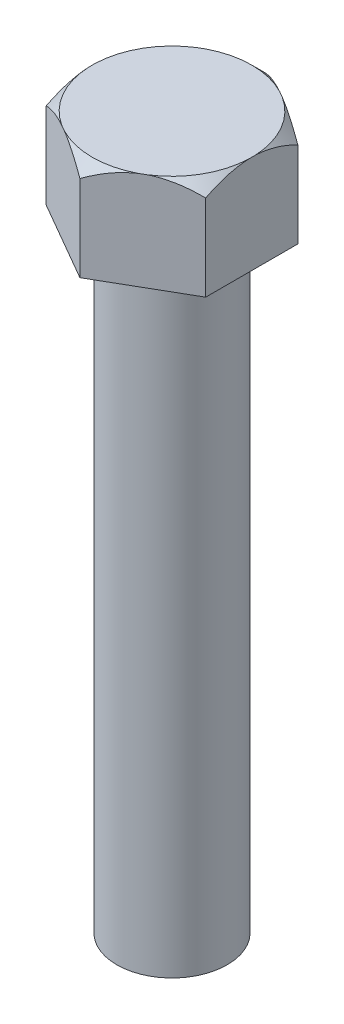
from build123d import *

# Parameters (mm, degrees)
SKETCH1_R           = 2.25
BOSS_EXTRUDE1_DEPTH = 25
BOSS_EXTRUDE2_DEPTH = 4


with BuildPart() as part:
    # Sketch1 → Boss-Extrude1 (new body)
    with BuildSketch(Plane(origin=(0, 0, 0), x_dir=(1, 0, 0), z_dir=(0, 1, 0))):
        with Locations(Location((0, 0, 0), (0, 0, 270))):
            Circle(SKETCH1_R)
    extrude(amount=BOSS_EXTRUDE1_DEPTH)

    # Sketch2 → Boss-Extrude2 (add)
    with BuildSketch(Plane(origin=(0, 25, 0), x_dir=(1, 0, 0), z_dir=(0, 1, 0))):
        Polygon((-3.25, -1.876388375), (0, -3.75277675), (3.25, -1.876388375), (3.25, 1.876388375), (0, 3.75277675), (-3.25, 1.876388375), align=None)
    extrude(amount=BOSS_EXTRUDE2_DEPTH)

    # Sketch4 → Cut-Revolve1 (revolve, cut)
    with BuildSketch(Plane(origin=(0, 0, 0), x_dir=(0, 0, -1), z_dir=(1, 0, 0))):
        Polygon((3.25277675, 29), (3.75277675, 28.5), (3.75277675, 29), align=None)
    revolve(axis=Axis((0, 0, 0), (0, 1, 0)), mode=Mode.SUBTRACT)


solid = part.part
